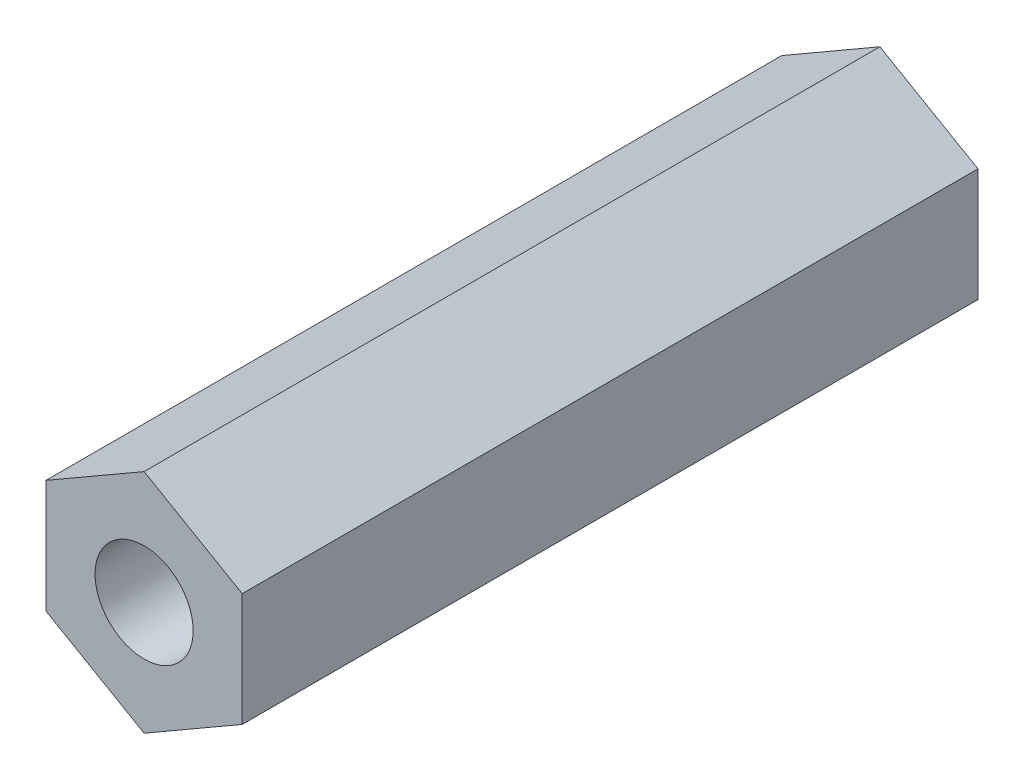
from build123d import *

# Parameters (mm, degrees)
ESQUISSE1_R        = 2
BOSS_EXTRU_1_DEPTH = 30


with BuildPart() as part:
    # Esquisse1 → Boss.-Extru.1 (new body)
    with BuildSketch(Plane.XY):
        Polygon((4, -2.309401077), (4, 2.309401077), (0, 4.618802154), (-4, 2.309401077), (-4, -2.309401077), (0, -4.618802154), align=None)
        Circle(ESQUISSE1_R, mode=Mode.SUBTRACT)
    extrude(amount=BOSS_EXTRU_1_DEPTH)


solid = part.part
